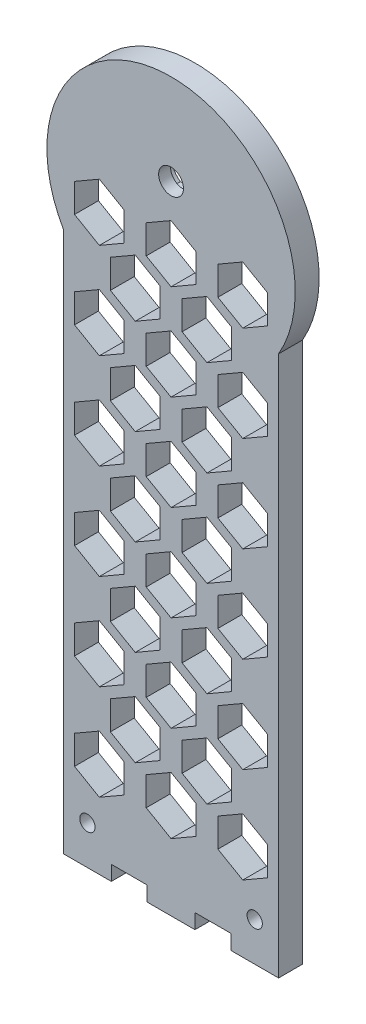
from build123d import *

# Parameters (mm, degrees)
EXTRUDE_1_DEPTH     = 5
SKETCH_2_R          = 1.6
SKETCH_2_W          = 7.5
SKETCH_2_H          = 3.1
CUT_EXTRUDE_1_DEPTH = 5
EXTRUDE_START       = -2.5
SKETCH_3_R          = 2.6
EXTRUDE_2_DEPTH     = 2.5


with BuildPart() as part:
    # 草图1 → 凸台-拉伸1 (new body)
    with BuildSketch(Plane.XY):
        with BuildLine():
            Line((0, 0), (45, 0))
            Line((45, 0), (45, 113.1))
            ThreePointArc((45, 113.1), (22.5, 152.07114317), (0, 113.1))
            Line((0, 113.1), (0, 0))
        make_face()
        with BuildLine():
            Line((19.44, 129.02), (25.56, 129.02))
            ThreePointArc((25.56, 129.02), (22.5, 138.2), (19.44, 129.02))
        make_face(mode=Mode.SUBTRACT)
    extrude(amount=EXTRUDE_1_DEPTH)

    # 草图2 → 切除-拉伸1 (cut)
    with BuildSketch(Plane.XY.offset(5)):
        with Locations((40, 8.1)):
            Circle(SKETCH_2_R)
        with Locations((5, 8.1)):
            Circle(SKETCH_2_R)
        with Locations((31.25, 1.55)):
            Rectangle(SKETCH_2_W, SKETCH_2_H)
        with Locations((13.75, 1.55)):
            Rectangle(SKETCH_2_W, SKETCH_2_H)
        Polygon((7.5, 26), (2.303847577, 23), (2.303847577, 17), (7.5, 14), (12.696152423, 17), (12.696152423, 23), align=None)
        Polygon((22.5, 26), (17.303847577, 23), (17.303847577, 17), (22.5, 14), (27.696152423, 17), (27.696152423, 23), align=None)
        Polygon((37.5, 26), (32.303847577, 23), (32.303847577, 17), (37.5, 14), (42.696152423, 17), (42.696152423, 23), align=None)
        Polygon((15, 56), (9.803847577, 53), (9.803847577, 47), (15, 44), (20.196152423, 47), (20.196152423, 53), align=None)
        Polygon((15, 36), (9.803847577, 33), (9.803847577, 27), (15, 24), (20.196152423, 27), (20.196152423, 33), align=None)
        Polygon((30, 36), (24.803847577, 33), (24.803847577, 27), (30, 24), (35.196152423, 27), (35.196152423, 33), align=None)
        Polygon((30, 56), (24.803847577, 53), (24.803847577, 47), (30, 44), (35.196152423, 47), (35.196152423, 53), align=None)
        Polygon((37.5, 46), (32.303847577, 43), (32.303847577, 37), (37.5, 34), (42.696152423, 37), (42.696152423, 43), align=None)
        Polygon((22.5, 46), (17.303847577, 43), (17.303847577, 37), (22.5, 34), (27.696152423, 37), (27.696152423, 43), align=None)
        Polygon((7.5, 46), (2.303847577, 43), (2.303847577, 37), (7.5, 34), (12.696152423, 37), (12.696152423, 43), align=None)
        Polygon((15, 76), (9.803847577, 73), (9.803847577, 67), (15, 64), (20.196152423, 67), (20.196152423, 73), align=None)
        Polygon((30, 76), (24.803847577, 73), (24.803847577, 67), (30, 64), (35.196152423, 67), (35.196152423, 73), align=None)
        Polygon((37.5, 66), (32.303847577, 63), (32.303847577, 57), (37.5, 54), (42.696152423, 57), (42.696152423, 63), align=None)
        Polygon((22.5, 66), (17.303847577, 63), (17.303847577, 57), (22.5, 54), (27.696152423, 57), (27.696152423, 63), align=None)
        Polygon((7.5, 66), (2.303847577, 63), (2.303847577, 57), (7.5, 54), (12.696152423, 57), (12.696152423, 63), align=None)
        Polygon((15, 96), (9.803847577, 93), (9.803847577, 87), (15, 84), (20.196152423, 87), (20.196152423, 93), align=None)
        Polygon((30, 96), (24.803847577, 93), (24.803847577, 87), (30, 84), (35.196152423, 87), (35.196152423, 93), align=None)
        Polygon((37.5, 86), (32.303847577, 83), (32.303847577, 77), (37.5, 74), (42.696152423, 77), (42.696152423, 83), align=None)
        Polygon((22.5, 86), (17.303847577, 83), (17.303847577, 77), (22.5, 74), (27.696152423, 77), (27.696152423, 83), align=None)
        Polygon((7.5, 86), (2.303847577, 83), (2.303847577, 77), (7.5, 74), (12.696152423, 77), (12.696152423, 83), align=None)
        Polygon((15, 116), (9.803847577, 113), (9.803847577, 107), (15, 104), (20.196152423, 107), (20.196152423, 113), align=None)
        Polygon((30, 116), (24.803847577, 113), (24.803847577, 107), (30, 104), (35.196152423, 107), (35.196152423, 113), align=None)
        Polygon((37.5, 106), (32.303847577, 103), (32.303847577, 97), (37.5, 94), (42.696152423, 97), (42.696152423, 103), align=None)
        Polygon((22.5, 106), (17.303847577, 103), (17.303847577, 97), (22.5, 94), (27.696152423, 97), (27.696152423, 103), align=None)
        Polygon((7.5, 106), (2.303847577, 103), (2.303847577, 97), (7.5, 94), (12.696152423, 97), (12.696152423, 103), align=None)
        Polygon((7.5, 126), (2.303847577, 123), (2.303847577, 117), (7.5, 114), (12.696152423, 117), (12.696152423, 123), align=None)
        Polygon((22.5, 126), (17.303847577, 123), (17.303847577, 117), (22.5, 114), (27.696152423, 117), (27.696152423, 123), align=None)
        Polygon((37.5, 126), (32.303847577, 123), (32.303847577, 117), (37.5, 114), (42.696152423, 117), (42.696152423, 123), align=None)
    extrude(amount=-CUT_EXTRUDE_1_DEPTH, mode=Mode.SUBTRACT)

    # 草图3 → 凸台-拉伸2 (add)
    with BuildSketch(Plane.XY.offset(5).offset(EXTRUDE_START)):
        with BuildLine():
            Line((19.44, 129.02), (25.56, 129.02))
            ThreePointArc((25.56, 129.02), (22.5, 138.2), (19.44, 129.02))
        make_face()
        with Locations((22.5, 133.1)):
            Circle(SKETCH_3_R, mode=Mode.SUBTRACT)
    extrude(amount=EXTRUDE_2_DEPTH)


solid = part.part
